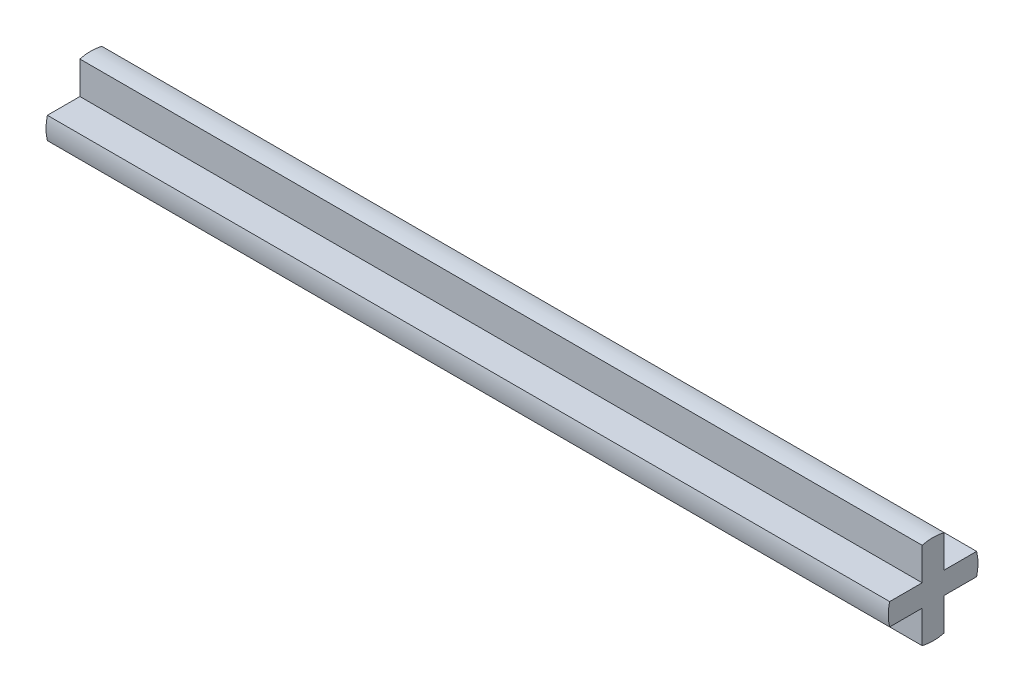
from build123d import *

# Parameters (mm, degrees)
SKETCH_1_R          = 2.45
EXTRUDE_1_DEPTH     = 23
SKETCH_2_OUTSIDE_W  = 16.204
SKETCH_2_OUTSIDE_H  = 16.204
CUT_EXTRUDE_1_DEPTH = 47.130304573


with BuildPart() as part:
    # 草图1 → 凸台-拉伸1 (new, symmetric)
    with BuildSketch(Plane(origin=(0, 0, 0), x_dir=(0, 0, -1), z_dir=(1, 0, 0))):
        Circle(SKETCH_1_R)
    extrude(amount=EXTRUDE_1_DEPTH, both=True)

    # 草图2 outside → 切除-拉伸1 (cut, through all)
    with BuildSketch(Plane(origin=(23, 0, 0), x_dir=(0, 0, -1), z_dir=(1, 0, 0))):
        Rectangle(SKETCH_2_OUTSIDE_W, SKETCH_2_OUTSIDE_H)
        Polygon((-3, 0.6), (-0.6, 0.6), (-0.6, 3), (0.6, 3), (0.6, 0.6), (3, 0.6), (3, -0.6), (0.6, -0.6), (0.6, -3), (-0.6, -3), (-0.6, -0.6), (-3, -0.6), align=None, mode=Mode.SUBTRACT)
    extrude(amount=-CUT_EXTRUDE_1_DEPTH, mode=Mode.SUBTRACT)


solid = part.part
